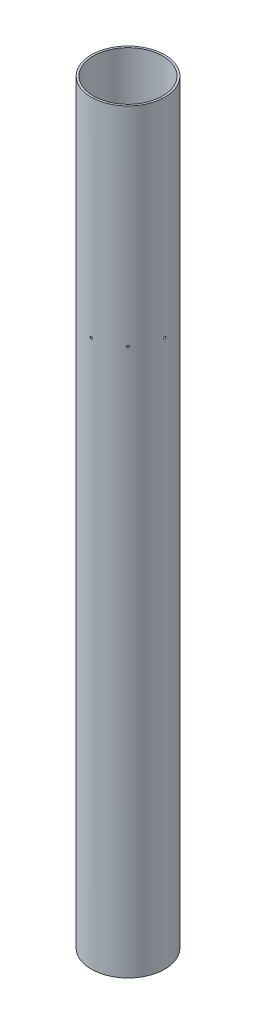
from build123d import *

# Parameters (mm, degrees)
SKETCH1_R                 = 53.721
SKETCH1_R_2               = 50.8
BODY_TUBE_EXTRUSION_DEPTH = 1104.9
BULKHEAD_HOLE_REACH       = 1113.411
BULKHEAD_HOLE_END_RADIUS  = 50.8
SKETCH2_R                 = 1.6383
CIRPATTERN1_COUNT         = 8


with BuildPart() as part:
    # Sketch1 → Body Tube Extrusion (new body)
    with BuildSketch(Plane(origin=(0, 0, 0), x_dir=(1, 0, 0), z_dir=(0, 1, 0))):
        Circle(SKETCH1_R)
        Circle(SKETCH1_R_2, mode=Mode.SUBTRACT)
    extrude(amount=BODY_TUBE_EXTRUSION_DEPTH)

    # Bulkhead Hole: up to this cylinder (the profile starts outside it)
    bulkhead_hole_end = Plane(origin=(0, 800.1, 0), z_dir=(0, -1, 0)) * Cylinder(BULKHEAD_HOLE_END_RADIUS, 2329.422, mode=Mode.PRIVATE)
    # Sketch2 → Bulkhead Hole (cut, up to the surface)
    with BuildSketch(Plane.XY.offset(53.721), mode=Mode.PRIVATE) as bulkhead_hole_sk1:
        with Locations((0, 800.1)):
            Circle(SKETCH2_R)
    bulkhead_hole_tool1 = extrude(bulkhead_hole_sk1.sketch, amount=-BULKHEAD_HOLE_REACH, mode=Mode.PRIVATE) - bulkhead_hole_end
    bulkhead_hole = bulkhead_hole_tool1.solids().sort_by_distance((0, 800.1, 53.721))[0]
    add(bulkhead_hole, mode=Mode.SUBTRACT)

    # CirPattern1: Bulkhead Hole ×8 about axis
    cirpattern1_axis = Axis((0, 1104.9, 0), (0, -1, 0))
    for i in range(1, CIRPATTERN1_COUNT):
        add(bulkhead_hole.rotate(cirpattern1_axis, i * 360 / CIRPATTERN1_COUNT), mode=Mode.SUBTRACT)


solid = part.part
